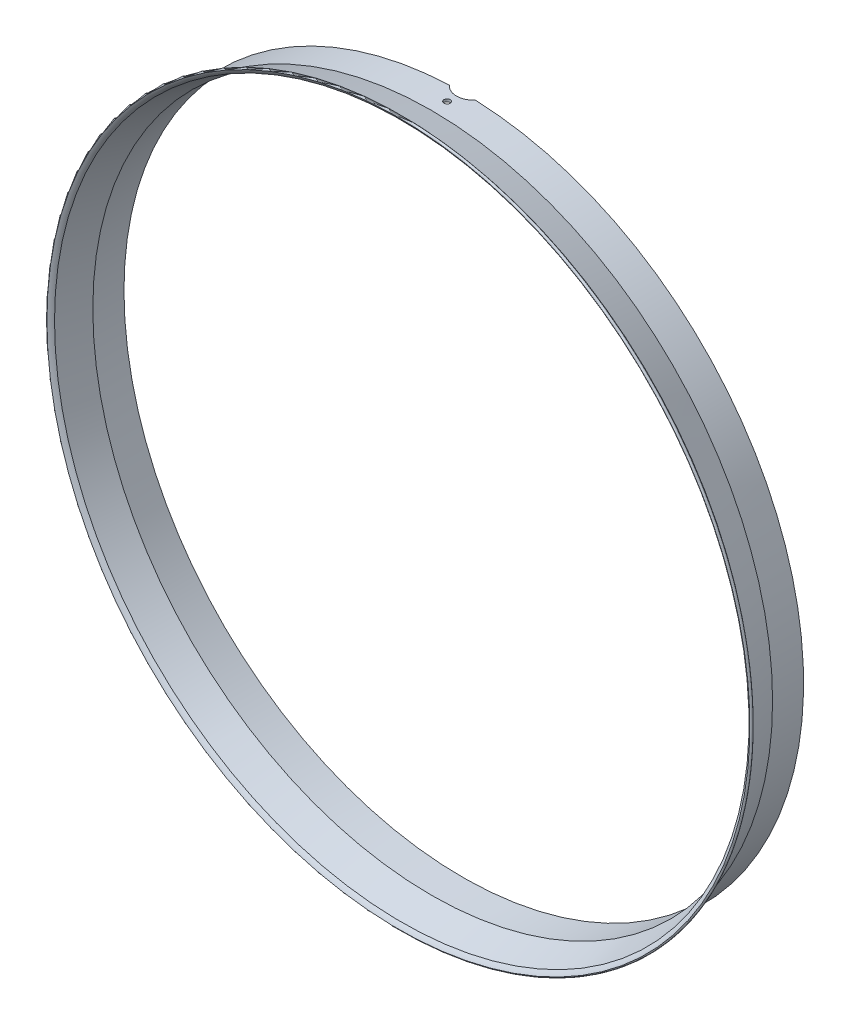
from build123d import *

# Parameters (mm, degrees)
SKETCH8_R          = 1.5
CUT_EXTRUDE1_DEPTH = 675.332492822


with BuildPart() as part:
    # Sketch1 → Revolve1 (revolve)
    with BuildSketch(Plane(origin=(-300, 0, 0), x_dir=(0, -1, 0), z_dir=(-1, 0, 0)), mode=Mode.PRIVATE) as revolve1_sk:
        with BuildLine():
            Line((-631.585161389, -424.526276491), (-635.785161389, -438.713521565))
            Line((-635.785161389, -438.713521565), (-635.785161389, -453.670006409))
            Line((-635.785161389, -453.670006409), (-634.585161389, -453.670006409))
            Line((-634.585161389, -453.670006409), (-634.585161389, -438.785397411))
            Line((-634.585161389, -438.785397411), (-630.582706756, -425.265443891))
            ThreePointArc((-630.582706756, -425.265443891), (-629.96855649, -424.639289663), (-629.250787995, -424.135247944))
            ThreePointArc((-629.250787995, -424.135247944), (-629.005156259, -423.410467755), (-629.571265705, -422.895529538))
            ThreePointArc((-629.571265705, -422.895529538), (-630.666584798, -423.601768681), (-631.585161389, -424.526276491))
        make_face()
    revolve(revolve1_sk.sketch.rotate(Axis((-300, 798.285161389, -417.264314325), (0, 0, -1)), 90), axis=Axis((-300, 798.285161389, -417.264314325), (0, 0, -1)))

    # Sketch8 → Cut-Extrude1 (cut, through all)
    with BuildSketch(Plane(origin=(0, 798.285161389, 0), x_dir=(1, 0, 0), z_dir=(0, 1, 0))):
        with Locations(Location((-300, 446.236353344, 0), (0, 0, 90))):
            Circle(SKETCH8_R)
        with BuildLine():
            Line((-293.808705408, 453.670006409), (-306.191294592, 453.670006409))
            ThreePointArc((-306.191294592, 453.670006409), (-300, 450.736353344), (-293.808705408, 453.670006409))
        make_face()
    extrude(amount=CUT_EXTRUDE1_DEPTH, mode=Mode.SUBTRACT)


solid = part.part
